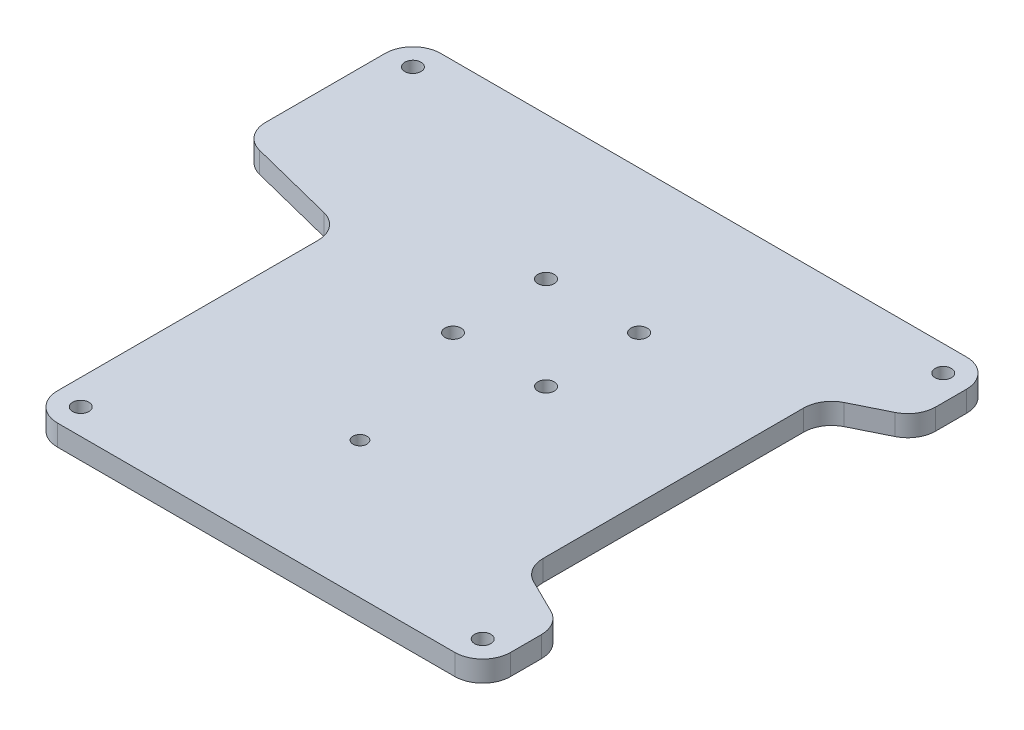
from build123d import *

# Parameters (mm, degrees)
SKETCH1_R           = 1.75
SKETCH1_R_2         = 1.5
BOSS_EXTRUDE1_DEPTH = 4.5


with BuildPart() as part:
    # Sketch1 → Boss-Extrude1 (new body)
    with BuildSketch(Plane(origin=(0, 0, 0), x_dir=(1, 0, 0), z_dir=(0, 1, 0))):
        with BuildLine():
            Line((-35.7, -55), (49.7, -55))
            ThreePointArc((49.7, -55), (53.942640687, -53.242640687), (55.7, -49))
            Line((55.7, -49), (55.7, -42.377818725))
            ThreePointArc((55.7, -42.377818725), (54.797249664, -39.212689049), (52.36065138, -37))
            Line((52.36065138, -37), (45.03934862, -33.377818725))
            ThreePointArc((45.03934862, -33.377818725), (42.602750336, -31.165129675), (41.7, -28))
            Line((41.7, -28), (41.7, 28))
            ThreePointArc((41.7, 28), (42.602750336, 31.165129675), (45.03934862, 33.377818725))
            Line((45.03934862, 33.377818725), (52.36065138, 37))
            ThreePointArc((52.36065138, 37), (54.797249664, 39.212689049), (55.7, 42.377818725))
            Line((55.7, 42.377818725), (55.7, 49))
            ThreePointArc((55.7, 49), (53.942640687, 53.242640687), (49.7, 55))
            Line((49.7, 55), (-63.3, 55))
            ThreePointArc((-63.3, 55), (-67.542640687, 53.242640687), (-69.3, 49))
            Line((-69.3, 49), (-69.3, 23.31729281))
            ThreePointArc((-69.3, 23.31729281), (-68.03372658, 19.630582533), (-64.769389112, 17.5))
            Line((-64.769389112, 17.5), (-46.230610888, 12.81729281))
            ThreePointArc((-46.230610888, 12.81729281), (-42.96627342, 10.686710277), (-41.7, 7))
            Line((-41.7, 7), (-41.7, -49))
            ThreePointArc((-41.7, -49), (-39.942640687, -53.242640687), (-35.7, -55))
        make_face()
        with Locations(Location((-63.8, 49.5, 0), (0, 0, 270))):
            Circle(SKETCH1_R, mode=Mode.SUBTRACT)
        with Locations(Location((-36.2, -49.5, 0), (0, 0, 270))):
            Circle(SKETCH1_R, mode=Mode.SUBTRACT)
        with Locations(Location((50.2, -49.5, 0), (0, 0, 270))):
            Circle(SKETCH1_R, mode=Mode.SUBTRACT)
        with Locations(Location((50.2, 49.5, 0), (0, 0, 270))):
            Circle(SKETCH1_R, mode=Mode.SUBTRACT)
        with Locations(Location((-10, 24.318057397, 0), (0, 0, 270))):
            Circle(SKETCH1_R, mode=Mode.SUBTRACT)
        with Locations(Location((-10, 4.318057397, 0), (0, 0, 270))):
            Circle(SKETCH1_R, mode=Mode.SUBTRACT)
        with Locations(Location((10, 4.318057397, 0), (0, 0, 270))):
            Circle(SKETCH1_R, mode=Mode.SUBTRACT)
        with Locations(Location((10, 24.318057397, 0), (0, 0, 270))):
            Circle(SKETCH1_R, mode=Mode.SUBTRACT)
        with Locations(Location((0, -25.681942603, 0), (0, 0, 270))):
            Circle(SKETCH1_R_2, mode=Mode.SUBTRACT)
    extrude(amount=BOSS_EXTRUDE1_DEPTH)


solid = part.part
